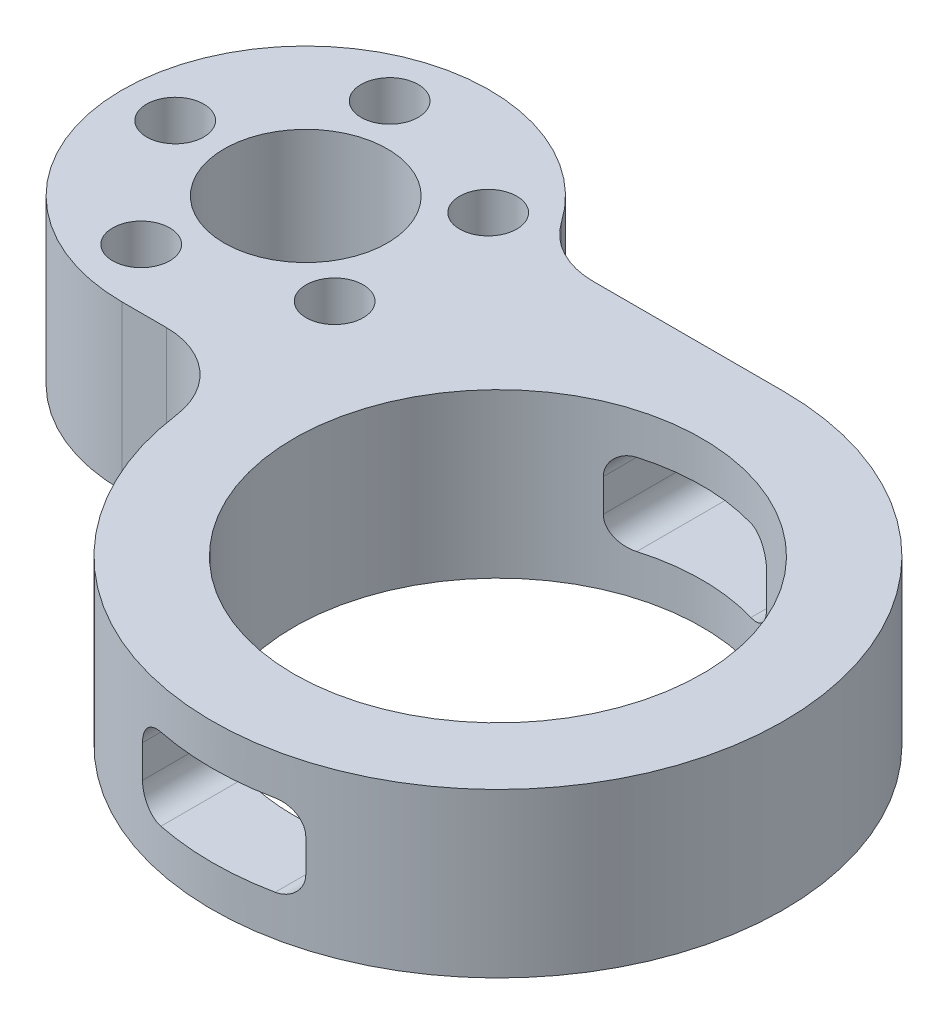
from build123d import *

# Parameters (mm, degrees)
SKETCH1_R               = 12.5
SKETCH1_R_2             = 5
SKETCH1_R_3             = 1.75
BOSS_EXTRUDE1_DEPTH     = 10
CUT_EXTRUDE1_DEPTH      = 45.869499914
CUT_EXTRUDE1_DEPTH_BACK = 45.869499914


with BuildPart() as part:
    # Sketch1 → Boss-Extrude1 (new body)
    with BuildSketch(Plane(origin=(0, 0, 0), x_dir=(1, 0, 0), z_dir=(0, 1, 0))):
        with BuildLine():
            Line((-25, 1.978756555), (-22.29623484, 1.978756555))
            ThreePointArc((-22.29623484, 1.978756555), (-19.006625225, 0.744187285), (-17.341515987, -2.349856013))
            ThreePointArc((-17.341515987, -2.349856013), (13.179007554, -11.513633653), (0, 17.5))
            Line((0, 17.5), (-11.654343591, 17.5))
            ThreePointArc((-11.654343591, 17.5), (-13.971297253, 18.069229669), (-15.760699409, 19.647309709))
            ThreePointArc((-15.760699409, 19.647309709), (-34.969233245, 18.441902296), (-25, 1.978756555))
        make_face()
        with Locations(Location((0, 0, 0), (0, 0, 270))):
            Circle(SKETCH1_R, mode=Mode.SUBTRACT)
        with Locations(Location((-25, 13.228756555, 0), (0, 0, 270))):
            Circle(SKETCH1_R_2, mode=Mode.SUBTRACT)
        with Locations(Location((-33, 13.228756555, 0), (0, 0, 270))):
            Circle(SKETCH1_R_3, mode=Mode.SUBTRACT)
        with Locations(Location((-27.472135955, 20.837208686, 0), (0, 0, 270))):
            Circle(SKETCH1_R_3, mode=Mode.SUBTRACT)
        with Locations(Location((-18.527864045, 17.931038574, 0), (0, 0, 270))):
            Circle(SKETCH1_R_3, mode=Mode.SUBTRACT)
        with Locations(Location((-18.527864045, 8.526474537, 0), (0, 0, 270))):
            Circle(SKETCH1_R_3, mode=Mode.SUBTRACT)
        with Locations(Location((-27.472135955, 5.620304425, 0), (0, 0, 270))):
            Circle(SKETCH1_R_3, mode=Mode.SUBTRACT)
    extrude(amount=BOSS_EXTRUDE1_DEPTH)

    # Sketch2 → Cut-Extrude1 (cut, two sides: drawn at the far end of the back side and taken through both)
    with BuildSketch(Plane.XY.offset(-CUT_EXTRUDE1_DEPTH_BACK)):
        with BuildLine():
            Line((-3.5, 7.5), (3.5, 7.5))
            ThreePointArc((3.5, 7.5), (4.560660172, 7.060660172), (5, 6))
            Line((5, 6), (5, 4))
            ThreePointArc((5, 4), (4.560660172, 2.939339828), (3.5, 2.5))
            Line((3.5, 2.5), (-3.5, 2.5))
            ThreePointArc((-3.5, 2.5), (-4.560660172, 2.939339828), (-5, 4))
            Line((-5, 4), (-5, 6))
            ThreePointArc((-5, 6), (-4.560660172, 7.060660172), (-3.5, 7.5))
        make_face()
    extrude(amount=CUT_EXTRUDE1_DEPTH + CUT_EXTRUDE1_DEPTH_BACK, mode=Mode.SUBTRACT)


solid = part.part
